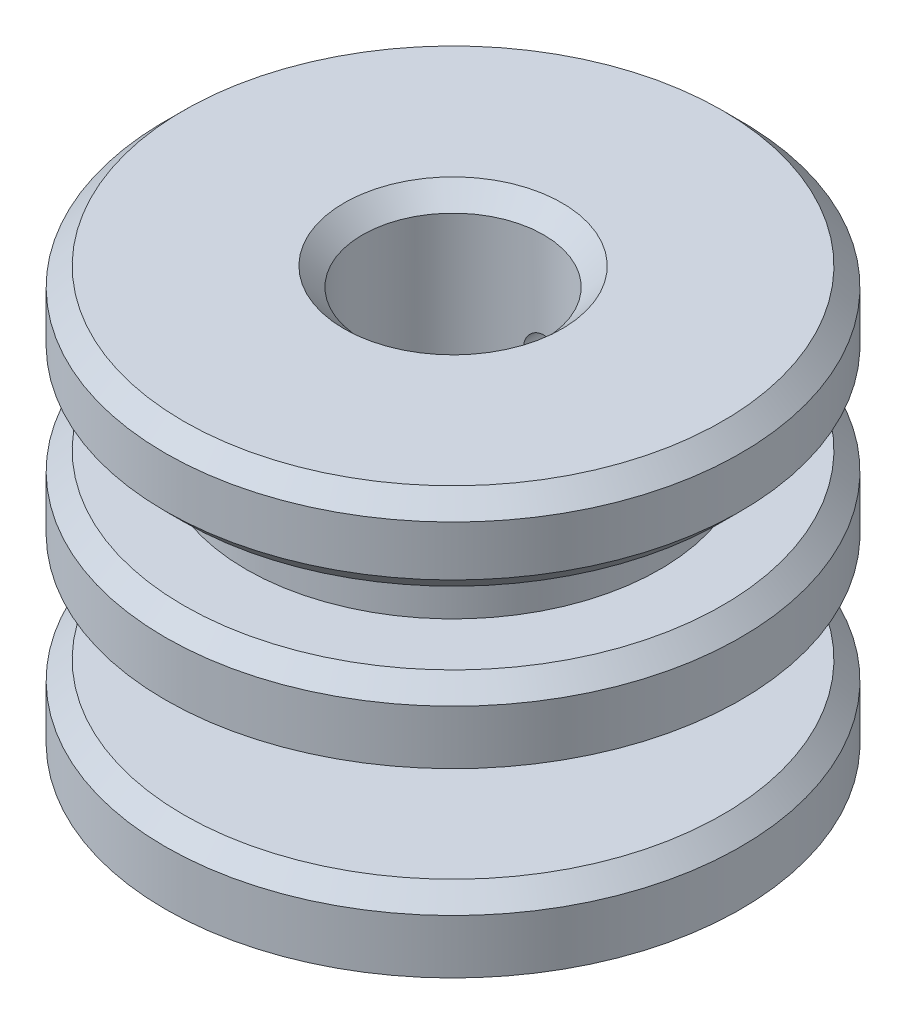
from build123d import *

# Parameters (mm, degrees)
SKETCH1_R           = 7.9375
SKETCH1_R_2         = 2.38125
BOSS_EXTRUDE1_DEPTH = 2
SKETCH2_R           = 3.3707324
SKETCH2_R_2         = 1.1375
BOSS_EXTRUDE2_DEPTH = 1.5
SKETCH3_R           = 3.3707324
SKETCH3_R_2         = 2.5
BOSS_EXTRUDE3_DEPTH = 1.5
SKETCH5_R           = 7.9375
SKETCH5_R_2         = 2.5
BOSS_EXTRUDE4_DEPTH = 2
SKETCH6_R           = 5.7060338
SKETCH6_R_2         = 2.5
BOSS_EXTRUDE5_DEPTH = 2
SKETCH7_R           = 7.9375
SKETCH7_R_2         = 2.5
BOSS_EXTRUDE6_DEPTH = 2.4
SKETCH8_R           = 0.5
CUT_EXTRUDE1_DEPTH  = 16.998994109
CHAMFER1_SIZE       = 0.508


with BuildPart() as part:
    # Sketch1 → Boss-Extrude1 (new body)
    with BuildSketch(Plane(origin=(0, 0, 0), x_dir=(1, 0, 0), z_dir=(0, 1, 0))):
        with Locations(Location((0, 0, 0), (0, 0, 270))):
            Circle(SKETCH1_R)
        with Locations(Location((0, 0, 0), (0, 0, 270))):
            Circle(SKETCH1_R_2, mode=Mode.SUBTRACT)
    extrude(amount=BOSS_EXTRUDE1_DEPTH)

    # Sketch2 → Boss-Extrude2 (add)
    with BuildSketch(Plane(origin=(0, 2, 0), x_dir=(1, 0, 0), z_dir=(0, 1, 0))):
        with Locations(Location((0, 0, 0), (0, 0, 270))):
            Circle(SKETCH2_R)
        with Locations(Location((0, 0, 0), (0, 0, 270))):
            Circle(SKETCH2_R_2, mode=Mode.SUBTRACT)
    extrude(amount=BOSS_EXTRUDE2_DEPTH)

    # Sketch3 → Boss-Extrude3 (add)
    with BuildSketch(Plane(origin=(0, 3.5, 0), x_dir=(1, 0, 0), z_dir=(0, 1, 0))):
        with Locations(Location((0, 0, 0), (0, 0, 270))):
            Circle(SKETCH3_R)
        with Locations(Location((0, 0, 0), (0, 0, 270))):
            Circle(SKETCH3_R_2, mode=Mode.SUBTRACT)
    extrude(amount=BOSS_EXTRUDE3_DEPTH)

    # Sketch5 → Boss-Extrude4 (add)
    with BuildSketch(Plane(origin=(0, 5, 0), x_dir=(1, 0, 0), z_dir=(0, 1, 0))):
        with Locations(Location((0, 0, 0), (0, 0, 270))):
            Circle(SKETCH5_R)
        with Locations(Location((0, 0, 0), (0, 0, 270))):
            Circle(SKETCH5_R_2, mode=Mode.SUBTRACT)
    extrude(amount=BOSS_EXTRUDE4_DEPTH)

    # Sketch6 → Boss-Extrude5 (add)
    with BuildSketch(Plane(origin=(0, 7, 0), x_dir=(1, 0, 0), z_dir=(0, 1, 0))):
        with Locations(Location((0, 0, 0), (0, 0, 270))):
            Circle(SKETCH6_R)
        with Locations(Location((0, 0, 0), (0, 0, 270))):
            Circle(SKETCH6_R_2, mode=Mode.SUBTRACT)
    extrude(amount=BOSS_EXTRUDE5_DEPTH)

    # Sketch7 → Boss-Extrude6 (add)
    with BuildSketch(Plane(origin=(0, 9, 0), x_dir=(1, 0, 0), z_dir=(0, 1, 0))):
        with Locations(Location((0, 0, 0), (0, 0, 270))):
            Circle(SKETCH7_R)
        with Locations(Location((0, 0, 0), (0, 0, 270))):
            Circle(SKETCH7_R_2, mode=Mode.SUBTRACT)
    extrude(amount=BOSS_EXTRUDE6_DEPTH)

    # Sketch8 → Cut-Extrude1 (cut, through all)
    with BuildSketch(Plane.XY):
        with Locations(Location((0, 8, 0), (0, 0, 90))):
            Circle(SKETCH8_R)
        with Locations(Location((0, 4, 0), (0, 0, 89.999999996))):
            Circle(SKETCH8_R)
    extrude(amount=-CUT_EXTRUDE1_DEPTH, mode=Mode.SUBTRACT)

    # Chamfer1
    chamfer1_edges = [part.edges().sort_by_distance(p)[0] for p in [
        (0, 7, -7.9375),
        (0, 11.4, -7.9375),
        (0, 9, -7.9375),
        (0, 11.4, -2.5),
        (0, 2, -7.9375),
    ]]
    chamfer(chamfer1_edges, length=CHAMFER1_SIZE)


solid = part.part
